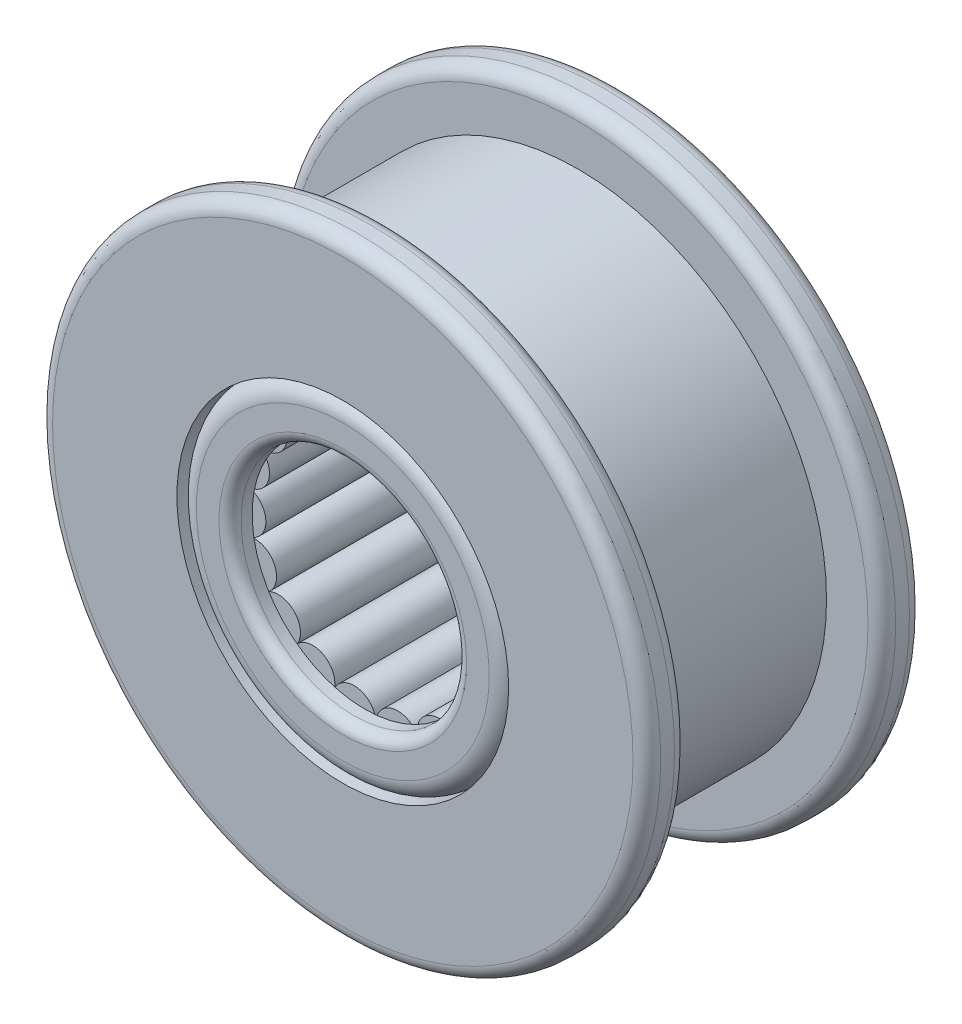
from build123d import *

# Parameters (mm, degrees)
FILLET1_R           = 0.79502
FILLET2_R           = 1.11252
FILLET3_R           = 0.635
BOSS_EXTRUDE1_START = -0.635
SKETCH3_R           = 1.27
BOSS_EXTRUDE1_DEPTH = 12.065
CIRPATTERN1_COUNT   = 19


with BuildPart() as part:
    # Sketch1 → Revolve1 (revolve)
    with BuildSketch(Plane(origin=(0, 0, 0), x_dir=(0, 0, -1), z_dir=(1, 0, 0)), mode=Mode.PRIVATE) as revolve1_sk:
        Polygon((13.49375, 17.4625), (15.875, 17.4625), (15.875, 9.525), (0, 9.525), (0, 17.4625), (2.38125, 17.4625), (2.38125, 14.2875), (13.49375, 14.2875), align=None)
    revolve(revolve1_sk.sketch.rotate(Axis((0, 0, 0), (0, 0, -1)), 90), axis=Axis((0, 0, 0), (0, 0, -1)))

    # Fillet1
    fillet1_edges = [part.edges().sort_by_distance(p)[0] for p in [
        (-17.4625, 0, -15.875),
        (-17.4625, 0, -13.49375),
        (-17.4625, 0, -2.38125),
        (-17.4625, 0, 0),
    ]]
    fillet(fillet1_edges, radius=FILLET1_R)


with BuildPart() as body_2:
    # Sketch2 → Revolve2 (revolve)
    with BuildSketch(Plane(origin=(0, 0, 0), x_dir=(0, 0, -1), z_dir=(1, 0, 0)), mode=Mode.PRIVATE) as revolve2_sk:
        Polygon((0, 6.477), (1.27, 6.477), (1.27, 8.255), (14.605, 8.255), (14.605, 6.477), (15.875, 6.477), (15.875, 9.525), (0, 9.525), align=None)
    revolve(revolve2_sk.sketch.rotate(Axis((0, 0, 0), (0, 0, -1)), 180), axis=Axis((0, 0, 0), (0, 0, -1)))

    # Fillet2
    fillet2_edges = [body_2.edges().sort_by_distance(p)[0] for p in [
        (0, 9.525, -15.875),
        (0, 9.525, 0),
    ]]
    fillet(fillet2_edges, radius=FILLET2_R)

    # Fillet3
    fillet3_edges = [body_2.edges().sort_by_distance(p)[0] for p in [
        (0, 6.477, 0),
        (0, 6.477, -15.875),
    ]]
    fillet(fillet3_edges, radius=FILLET3_R)


with BuildPart() as body_3:
    # Sketch3 → Boss-Extrude1 (new body)
    with BuildSketch(Plane.XY.offset(-1.27).offset(BOSS_EXTRUDE1_START)):
        with Locations((0, 7.62)):
            Circle(SKETCH3_R)
    extrude(amount=-BOSS_EXTRUDE1_DEPTH)


with BuildPart() as cirpattern1_1:
    # CirPattern1: pattern copy
    add(body_3.part.rotate(Axis((0, 0, 0), (0, 0, 1)), 1 * 360 / CIRPATTERN1_COUNT))


with BuildPart() as cirpattern1_2:
    # CirPattern1: pattern copy
    add(body_3.part.rotate(Axis((0, 0, 0), (0, 0, 1)), 2 * 360 / CIRPATTERN1_COUNT))


with BuildPart() as cirpattern1_3:
    # CirPattern1: pattern copy
    add(body_3.part.rotate(Axis((0, 0, 0), (0, 0, 1)), 3 * 360 / CIRPATTERN1_COUNT))


with BuildPart() as cirpattern1_4:
    # CirPattern1: pattern copy
    add(body_3.part.rotate(Axis((0, 0, 0), (0, 0, 1)), 4 * 360 / CIRPATTERN1_COUNT))


with BuildPart() as cirpattern1_5:
    # CirPattern1: pattern copy
    add(body_3.part.rotate(Axis((0, 0, 0), (0, 0, 1)), 5 * 360 / CIRPATTERN1_COUNT))


with BuildPart() as cirpattern1_6:
    # CirPattern1: pattern copy
    add(body_3.part.rotate(Axis((0, 0, 0), (0, 0, 1)), 6 * 360 / CIRPATTERN1_COUNT))


with BuildPart() as cirpattern1_7:
    # CirPattern1: pattern copy
    add(body_3.part.rotate(Axis((0, 0, 0), (0, 0, 1)), 7 * 360 / CIRPATTERN1_COUNT))


with BuildPart() as cirpattern1_8:
    # CirPattern1: pattern copy
    add(body_3.part.rotate(Axis((0, 0, 0), (0, 0, 1)), 8 * 360 / CIRPATTERN1_COUNT))


with BuildPart() as cirpattern1_9:
    # CirPattern1: pattern copy
    add(body_3.part.rotate(Axis((0, 0, 0), (0, 0, 1)), 9 * 360 / CIRPATTERN1_COUNT))


with BuildPart() as cirpattern1_10:
    # CirPattern1: pattern copy
    add(body_3.part.rotate(Axis((0, 0, 0), (0, 0, 1)), 10 * 360 / CIRPATTERN1_COUNT))


with BuildPart() as cirpattern1_11:
    # CirPattern1: pattern copy
    add(body_3.part.rotate(Axis((0, 0, 0), (0, 0, 1)), 11 * 360 / CIRPATTERN1_COUNT))


with BuildPart() as cirpattern1_12:
    # CirPattern1: pattern copy
    add(body_3.part.rotate(Axis((0, 0, 0), (0, 0, 1)), 12 * 360 / CIRPATTERN1_COUNT))


with BuildPart() as cirpattern1_13:
    # CirPattern1: pattern copy
    add(body_3.part.rotate(Axis((0, 0, 0), (0, 0, 1)), 13 * 360 / CIRPATTERN1_COUNT))


with BuildPart() as cirpattern1_14:
    # CirPattern1: pattern copy
    add(body_3.part.rotate(Axis((0, 0, 0), (0, 0, 1)), 14 * 360 / CIRPATTERN1_COUNT))


with BuildPart() as cirpattern1_15:
    # CirPattern1: pattern copy
    add(body_3.part.rotate(Axis((0, 0, 0), (0, 0, 1)), 15 * 360 / CIRPATTERN1_COUNT))


with BuildPart() as cirpattern1_16:
    # CirPattern1: pattern copy
    add(body_3.part.rotate(Axis((0, 0, 0), (0, 0, 1)), 16 * 360 / CIRPATTERN1_COUNT))


with BuildPart() as cirpattern1_17:
    # CirPattern1: pattern copy
    add(body_3.part.rotate(Axis((0, 0, 0), (0, 0, 1)), 17 * 360 / CIRPATTERN1_COUNT))


with BuildPart() as cirpattern1_18:
    # CirPattern1: pattern copy
    add(body_3.part.rotate(Axis((0, 0, 0), (0, 0, 1)), 18 * 360 / CIRPATTERN1_COUNT))


solid = Compound([part.part, body_2.part, body_3.part, cirpattern1_1.part, cirpattern1_2.part, cirpattern1_3.part, cirpattern1_4.part, cirpattern1_5.part, cirpattern1_6.part, cirpattern1_7.part, cirpattern1_8.part, cirpattern1_9.part, cirpattern1_10.part, cirpattern1_11.part, cirpattern1_12.part, cirpattern1_13.part, cirpattern1_14.part, cirpattern1_15.part, cirpattern1_16.part, cirpattern1_17.part, cirpattern1_18.part])
